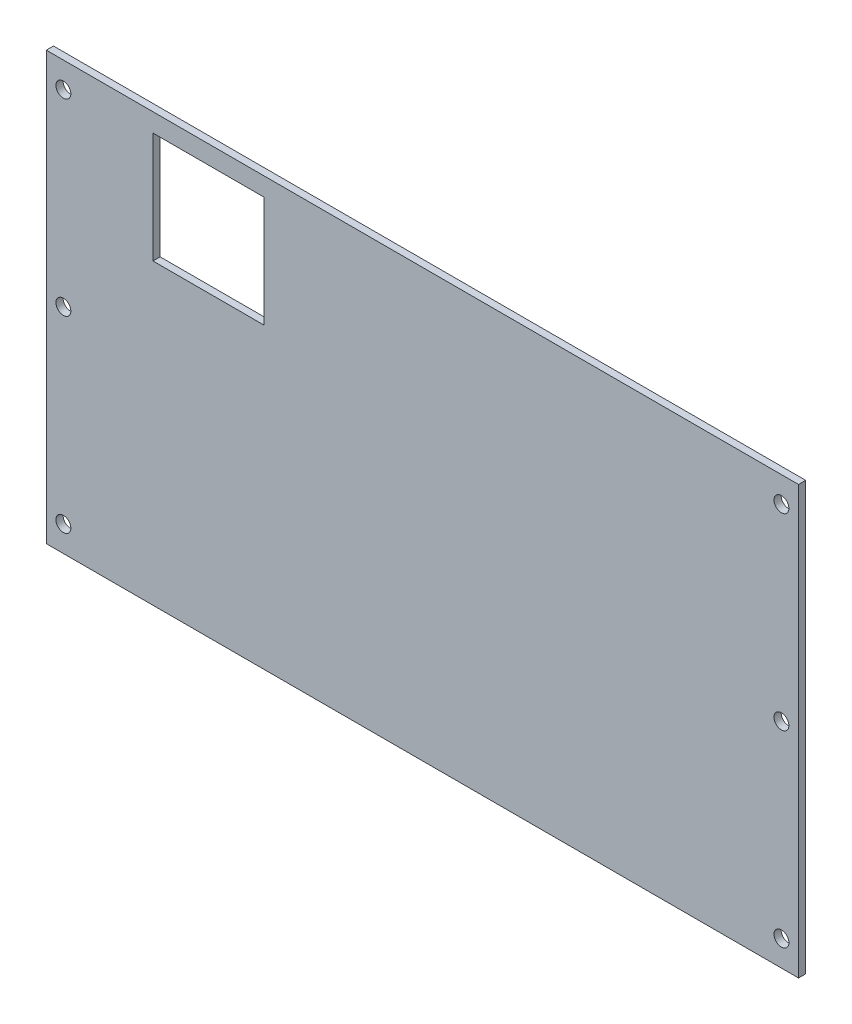
from build123d import *

# Parameters (mm, degrees)
SKETCH1_W           = 279.4
SKETCH1_H           = 158.75
BOSS_EXTRUDE1_DEPTH = 2.667
SKETCH2_W           = 41.148
SKETCH2_H           = 41.148
CUT_EXTRUDE1_DEPTH  = 47.752
SKETCH3_R           = 2.7686
CUT_EXTRUDE2_DEPTH  = 322.361222597


with BuildPart() as part:
    # Sketch1 → Boss-Extrude1 (new body)
    with BuildSketch(Plane.XY):
        with Locations((139.7, 79.375)):
            Rectangle(SKETCH1_W, SKETCH1_H)
    extrude(amount=BOSS_EXTRUDE1_DEPTH)

    # Sketch2 → Cut-Extrude1 (cut)
    with BuildSketch(Plane.XY):
        with Locations((60.198, 131.318)):
            Rectangle(SKETCH2_W, SKETCH2_H)
    extrude(amount=CUT_EXTRUDE1_DEPTH, mode=Mode.SUBTRACT)

    # Sketch3 → Cut-Extrude2 (cut, through all)
    with BuildSketch(Plane.XY):
        with Locations((6.35, 9.525)):
            Circle(SKETCH3_R)
        with Locations((6.35, 79.375)):
            Circle(SKETCH3_R)
        with Locations((6.35, 149.225)):
            Circle(SKETCH3_R)
        with Locations((273.05, 9.525)):
            Circle(SKETCH3_R)
        with Locations((273.05, 79.375)):
            Circle(SKETCH3_R)
        with Locations((273.05, 149.225)):
            Circle(SKETCH3_R)
    extrude(amount=CUT_EXTRUDE2_DEPTH, mode=Mode.SUBTRACT)


solid = part.part
